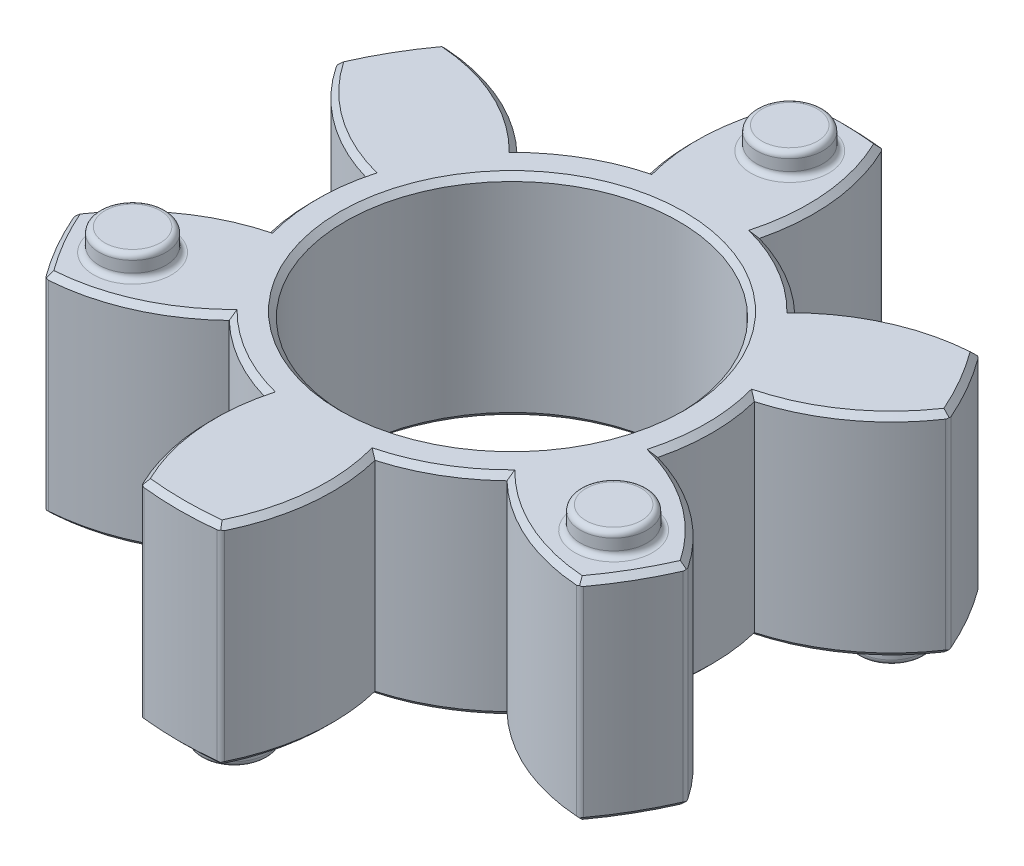
from build123d import *

# Parameters (mm, degrees)
BODY_SKETCH_R            = 15
BODY_DEPTH               = 4.75
BODY_HOLE_DEPTH          = 22.738502708
BODY_HOLE_DEPTH_BACK     = 22.738502708
BODY_HOLE_SKETCH_R       = 7.5
LEGS_DEPTH               = 22.738502708
LEGS_DEPTH_BACK          = 22.738502708
LEG_SKECH_OUTSIDE_W      = 40.696
LEG_SKECH_OUTSIDE_H      = 40.696
AESTHETIC_CHAMFER_SIZE   = 0.25
TOP_START                = 4.75
TOP_DISTANCE_SKETCH_R    = 1.5
TOP_DISTANCE_DEPTH       = 1
BOTTOM_START             = -4.75
BOTTOM_DISTANCE_SKETCH_R = 1.5
BOTTOM_DISTANCE_DEPTH    = 1
AESTHETIC_FILLET_R       = 0.25


with BuildPart() as part:
    # Body Sketch → Body (new, symmetric)
    with BuildSketch(Plane(origin=(0, 0, 0), x_dir=(1, 0, 0), z_dir=(0, 1, 0))):
        with Locations(Location((0, 0, 0), (0, 0, 270))):
            Circle(BODY_SKETCH_R)
    extrude(amount=BODY_DEPTH, both=True)

    # Body Hole Sketch → Body Hole (cut, two sides: drawn at the far end of the back side and taken through both)
    with BuildSketch(Plane(origin=(0, 0, 0), x_dir=(1, 0, 0), z_dir=(0, 1, 0)).offset(-BODY_HOLE_DEPTH_BACK)):
        with Locations(Location((0, 0, 0), (0, 0, 270))):
            Circle(BODY_HOLE_SKETCH_R)
    extrude(amount=BODY_HOLE_DEPTH + BODY_HOLE_DEPTH_BACK, mode=Mode.SUBTRACT)

    # Leg Skech outside → Legs (cut, two sides: drawn at the far end of the back side and taken through both)
    with BuildSketch(Plane(origin=(0, 0, 0), x_dir=(1, 0, 0), z_dir=(0, 1, 0)).offset(-LEGS_DEPTH_BACK)):
        Rectangle(LEG_SKECH_OUTSIDE_W, LEG_SKECH_OUTSIDE_H)
        with BuildLine():
            ThreePointArc((-2.483308569, 8.650617235), (-4.5, 7.794228634), (-6.25, 6.475916923))
            ThreePointArc((-6.25, 6.475916923), (-10.325299688, 8.733308569), (-14.983308569, 8.650617235))
            ThreePointArc((-14.983308569, 8.650617235), (-12.725916923, 4.575317547), (-8.733308569, 2.174700312))
            ThreePointArc((-8.733308569, 2.174700312), (-9, 0), (-8.733308569, -2.174700312))
            ThreePointArc((-8.733308569, -2.174700312), (-12.725916923, -4.575317547), (-14.983308569, -8.650617235))
            ThreePointArc((-14.983308569, -8.650617235), (-10.325299688, -8.733308569), (-6.25, -6.475916923))
            ThreePointArc((-6.25, -6.475916923), (-4.5, -7.794228634), (-2.483308569, -8.650617235))
            ThreePointArc((-2.483308569, -8.650617235), (-2.400617235, -13.308626116), (0, -17.301234471))
            ThreePointArc((0, -17.301234471), (2.400617235, -13.308626116), (2.483308569, -8.650617235))
            ThreePointArc((2.483308569, -8.650617235), (4.5, -7.794228634), (6.25, -6.475916923))
            ThreePointArc((6.25, -6.475916923), (10.325299688, -8.733308569), (14.983308569, -8.650617235))
            ThreePointArc((14.983308569, -8.650617235), (12.725916923, -4.575317547), (8.733308569, -2.174700312))
            ThreePointArc((8.733308569, -2.174700312), (9, 0), (8.733308569, 2.174700312))
            ThreePointArc((8.733308569, 2.174700312), (12.725916923, 4.575317547), (14.983308569, 8.650617235))
            ThreePointArc((14.983308569, 8.650617235), (10.325299688, 8.733308569), (6.25, 6.475916923))
            ThreePointArc((6.25, 6.475916923), (4.5, 7.794228634), (2.483308569, 8.650617235))
            ThreePointArc((2.483308569, 8.650617235), (2.400617235, 13.308626116), (0, 17.301234471))
            ThreePointArc((0, 17.301234471), (-2.400617235, 13.308626116), (-2.483308569, 8.650617235))
        make_face(mode=Mode.SUBTRACT)
    extrude(amount=LEGS_DEPTH + LEGS_DEPTH_BACK, mode=Mode.SUBTRACT)

    # Aesthetic Chamfer
    aesthetic_chamfer_edges = [part.edges().sort_by_distance(p)[0] for p in [
        (12.990381057, -4.75, 7.5),
        (12.990381057, -4.75, -7.5),
        (0, -4.75, -15),
        (-12.990381057, -4.75, -7.5),
        (-12.990381057, -4.75, 7.5),
        (0, -4.75, 15),
        (-8.903773274, -4.75, 8.250282015),
        (-11.596840451, -4.75, -3.585752837),
        (-2.693067177, -4.75, -11.836034852),
        (8.903773274, -4.75, -8.250282015),
        (11.596840451, -4.75, 3.585752837),
        (2.693067177, -4.75, 11.836034852),
        (12.990381057, 4.75, 7.5),
        (12.990381057, 4.75, -7.5),
        (0, 4.75, -15),
        (-12.990381057, 4.75, -7.5),
        (-12.990381057, 4.75, 7.5),
        (0, 4.75, 15),
        (4.5, -4.75, 7.794228634),
        (8.903773274, -4.75, 8.250282015),
        (9, -4.75, 0),
        (11.596840451, -4.75, -3.585752837),
        (4.5, -4.75, -7.794228634),
        (2.693067177, -4.75, -11.836034852),
        (-4.5, -4.75, -7.794228634),
        (-8.903773274, -4.75, -8.250282015),
        (-9, -4.75, 0),
        (-11.596840451, -4.75, 3.585752837),
        (-4.5, -4.75, 7.794228634),
        (-2.693067177, -4.75, 11.836034852),
        (-2.693067177, 4.75, 11.836034852),
        (2.693067177, 4.75, 11.836034852),
        (8.903773274, 4.75, 8.250282015),
        (11.596840451, 4.75, 3.585752837),
        (11.596840451, 4.75, -3.585752837),
        (8.903773274, 4.75, -8.250282015),
        (2.693067177, 4.75, -11.836034852),
        (-2.693067177, 4.75, -11.836034852),
        (-8.903773274, 4.75, -8.250282015),
        (-11.596840451, 4.75, -3.585752837),
        (-11.596840451, 4.75, 3.585752837),
        (-8.903773274, 4.75, 8.250282015),
        (4.5, 4.75, 7.794228634),
        (9, 4.75, 0),
        (4.5, 4.75, -7.794228634),
        (-4.5, 4.75, -7.794228634),
        (-9, 4.75, 0),
        (-4.5, 4.75, 7.794228634),
        (0, -4.75, -7.5),
        (0, 4.75, -7.5),
    ]]
    chamfer(aesthetic_chamfer_edges, length=AESTHETIC_CHAMFER_SIZE)

    # Top Distance Sketch → Top Distance (add)
    with BuildSketch(Plane(origin=(0, 0, 0), x_dir=(1, 0, 0), z_dir=(0, 1, 0)).offset(TOP_START)):
        with Locations(Location((0, 12.5, 0), (0, 0, 270))):
            Circle(TOP_DISTANCE_SKETCH_R)
        with Locations(Location((10.825317547, -6.25, 0), (0, 0, 270))):
            Circle(TOP_DISTANCE_SKETCH_R)
        with Locations(Location((-10.825317547, -6.25, 0), (0, 0, 270))):
            Circle(TOP_DISTANCE_SKETCH_R)
    extrude(amount=TOP_DISTANCE_DEPTH)

    # Bottom Distance Sketch → Bottom Distance (add)
    with BuildSketch(Plane(origin=(0, 0, 0), x_dir=(1, 0, 0), z_dir=(0, 1, 0)).offset(BOTTOM_START)):
        with Locations(Location((0, -12.5, 0), (0, 0, 270))):
            Circle(BOTTOM_DISTANCE_SKETCH_R)
        with Locations(Location((-10.825317547, 6.25, 0), (0, 0, 270))):
            Circle(BOTTOM_DISTANCE_SKETCH_R)
        with Locations(Location((10.825317547, 6.25, 0), (0, 0, 270))):
            Circle(BOTTOM_DISTANCE_SKETCH_R)
    extrude(amount=-BOTTOM_DISTANCE_DEPTH)

    # Aesthetic Fillet
    aesthetic_fillet_edges = [part.edges().sort_by_distance(p)[0] for p in [
        (12.01, 0, 8.986651212),
        (13.787668244, 0, 5.907639494),
        (13.787668244, 0, -5.907639494),
        (12.01, 0, -8.986651212),
        (1.777668244, 0, -14.894290705),
        (-1.777668244, 0, -14.894290705),
        (-12.01, 0, -8.986651212),
        (-13.787668244, 0, -5.907639494),
        (-13.787668244, 0, 5.907639494),
        (-12.01, 0, 8.986651212),
        (-1.777668244, 0, 14.894290705),
        (1.777668244, 0, 14.894290705),
        (0, 4.75, -14),
        (0, 5.75, -14),
        (10.825317547, 4.75, 4.75),
        (10.825317547, 5.75, 4.75),
        (-10.825317547, 4.75, 4.75),
        (-10.825317547, 5.75, 4.75),
        (-10.825317547, -4.75, -7.75),
        (-10.825317547, -5.75, -7.75),
        (10.825317547, -4.75, -7.75),
        (10.825317547, -5.75, -7.75),
        (0, -4.75, 11),
        (0, -5.75, 11),
    ]]
    fillet(aesthetic_fillet_edges, radius=AESTHETIC_FILLET_R)


solid = part.part
